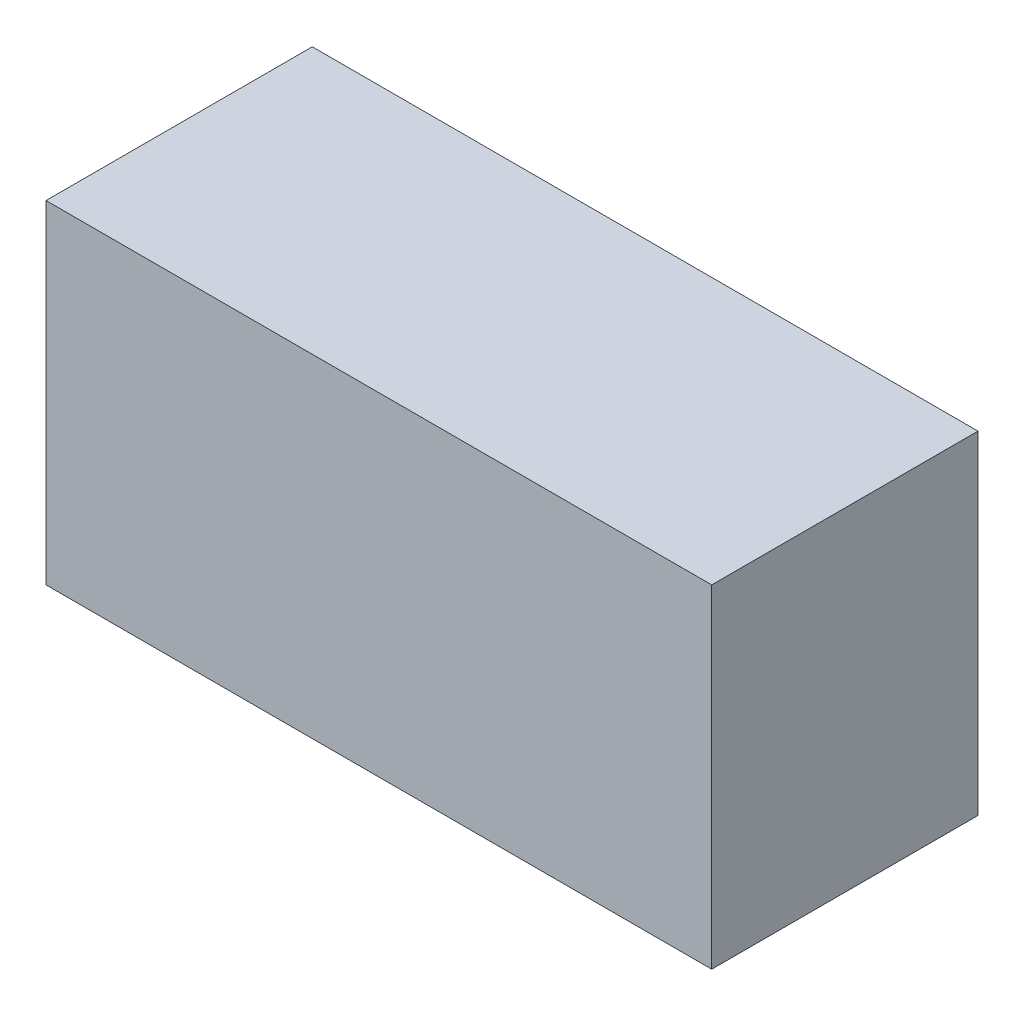
from build123d import *

# Parameters (mm, degrees)
SKETCH1_W           = 100
SKETCH1_H           = 50
BOSS_EXTRUDE1_DEPTH = 40


with BuildPart() as part:
    # Sketch1 → Boss-Extrude1 (new body)
    with BuildSketch(Plane.XY):
        with Locations((0, 25)):
            Rectangle(SKETCH1_W, SKETCH1_H)
    extrude(amount=-BOSS_EXTRUDE1_DEPTH)


solid = part.part
